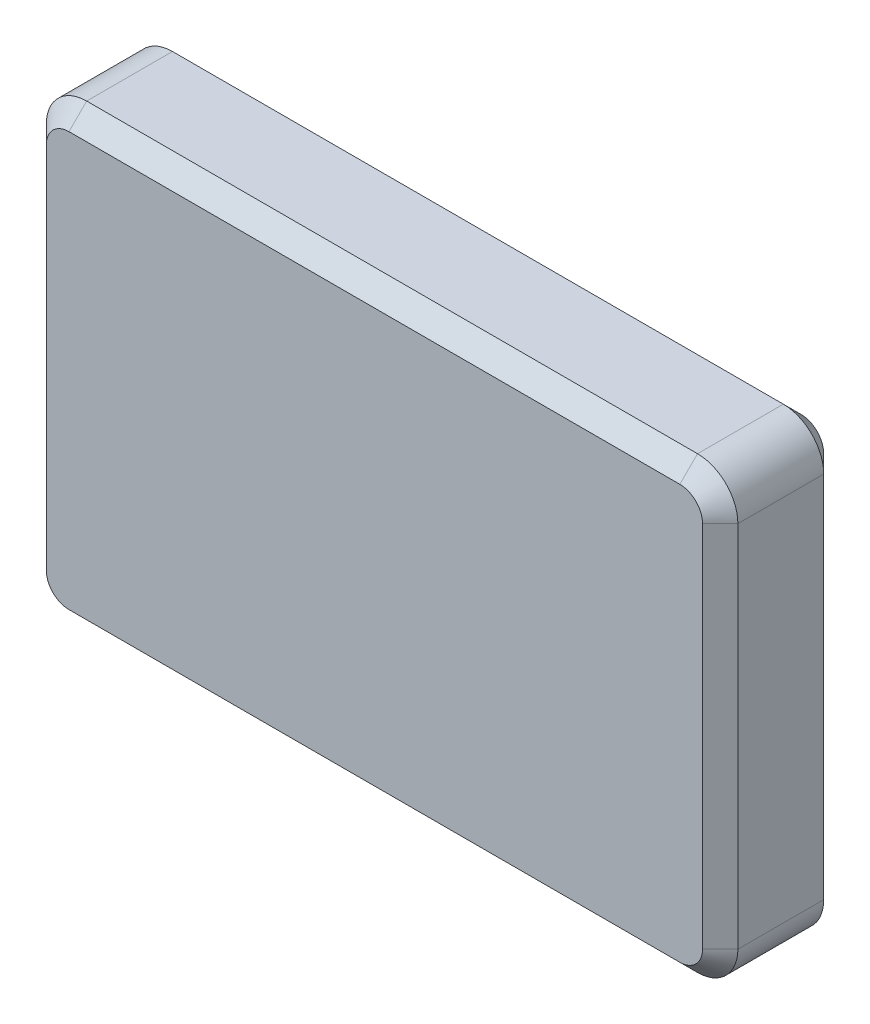
from build123d import *

# Parameters (mm, degrees)
SKETCH1_W           = 137
SKETCH1_H           = 89
BOSS_EXTRUDE1_DEPTH = 24
FILLET2_R           = 8
CHAMFER2_SIZE       = 3.5
SKETCH2_W           = 51.5
SKETCH2_H           = 9.8
CUT_EXTRUDE1_DEPTH  = 2
SKETCH3_R           = 3
SKETCH3_W           = 5
SKETCH3_H           = 12.5
SKETCH3_W_2         = 7
SKETCH3_H_2         = 8.5
CUT_EXTRUDE2_DEPTH  = 10


with BuildPart() as part:
    # Sketch1 → Boss-Extrude1 (new body)
    with BuildSketch(Plane.XY):
        Rectangle(SKETCH1_W, SKETCH1_H)
    extrude(amount=BOSS_EXTRUDE1_DEPTH)

    # Fillet2
    fillet2_edges = [part.edges().sort_by_distance(p)[0] for p in [
        (-68.5, 44.5, 12),
        (68.5, 44.5, 12),
        (68.5, -44.5, 12),
        (-68.5, -44.5, 12),
    ]]
    fillet(fillet2_edges, radius=FILLET2_R)

    # Chamfer2
    chamfer2_edges = [part.edges().sort_by_distance(p)[0] for p in [
        (0, 44.5, 0),
        (0, 44.5, 24),
        (-68.5, 0, 0),
        (68.5, 0, 0),
        (0, -44.5, 0),
        (-66.156854249, 42.156854249, 0),
        (-66.156854249, -42.156854249, 0),
        (66.156854249, -42.156854249, 0),
        (66.156854249, 42.156854249, 0),
        (68.5, 0, 24),
        (-68.5, 0, 24),
        (0, -44.5, 24),
        (-66.156854249, 42.156854249, 24),
        (-66.156854249, -42.156854249, 24),
        (66.156854249, -42.156854249, 24),
        (66.156854249, 42.156854249, 24),
    ]]
    chamfer(chamfer2_edges, length=CHAMFER2_SIZE)

    # Sketch2 → Cut-Extrude1 (cut)
    with BuildSketch(Plane.XZ.offset(44.5)):
        with Locations((-28.75, 13.5)):
            Rectangle(SKETCH2_W, SKETCH2_H)
        with Locations((28.75, 13.5)):
            Rectangle(SKETCH2_W, SKETCH2_H)
    extrude(amount=-CUT_EXTRUDE1_DEPTH, mode=Mode.SUBTRACT)

    # Sketch3 → Cut-Extrude2 (cut)
    with BuildSketch(Plane.ZY.offset(68.5)):
        with Locations((16, -11.5)):
            Circle(SKETCH3_R)
        with Locations((12.5, 19.25)):
            Rectangle(SKETCH3_W, SKETCH3_H)
        with Locations((13.5, 2.75)):
            Rectangle(SKETCH3_W_2, SKETCH3_H_2)
    extrude(amount=-CUT_EXTRUDE2_DEPTH, mode=Mode.SUBTRACT)


solid = part.part
